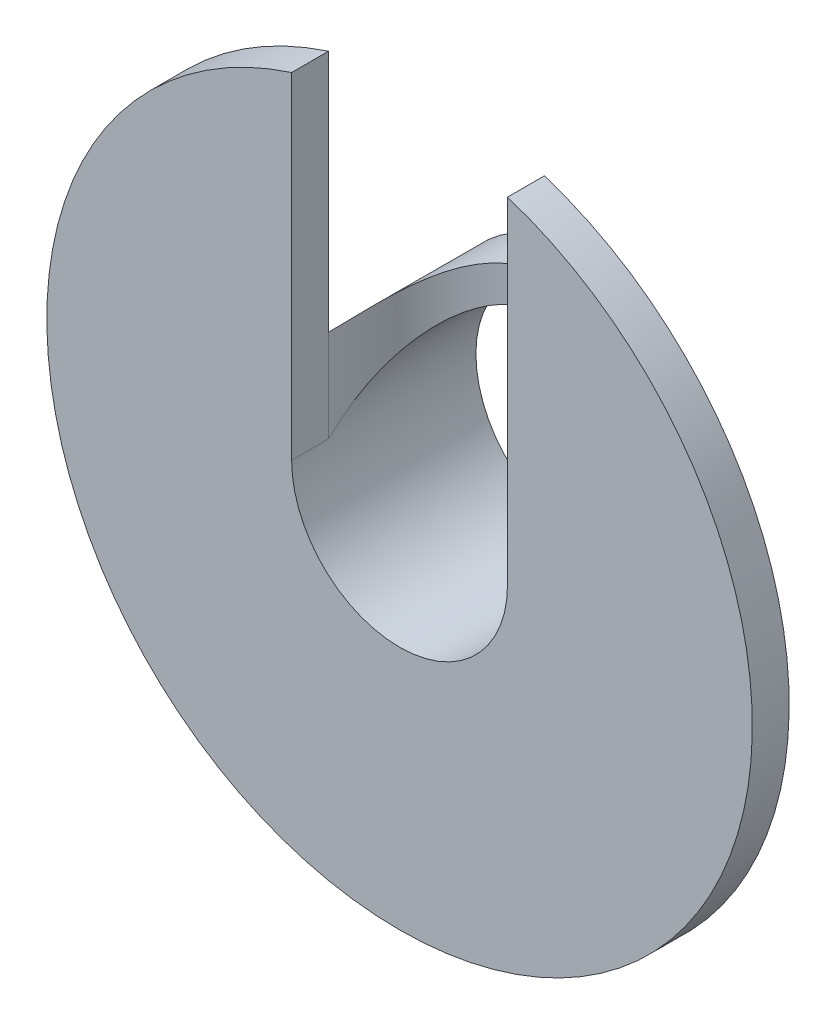
from build123d import *

# Parameters (mm, degrees)
BOSS_EXTRU_1_DEPTH      = 1.4
BOSS_EXTRU_2_START      = -7
ESQUISSE2_R             = 5.4
ESQUISSE2_R_2           = 4.1
BOSS_EXTRU_2_DEPTH      = 7
ENL_V_MAT_EXTRU_1_DEPTH = 7


with BuildPart() as part:
    # Esquisse1 → Boss.-Extru.1 (new body)
    with BuildSketch(Plane.XY):
        with BuildLine():
            Line((4.1, 0), (4.1, 12.757350822))
            ThreePointArc((4.1, 12.757350822), (0, -13.4), (-4.1, 12.757350822))
            Line((-4.1, 12.757350822), (-4.1, 0))
            ThreePointArc((-4.1, 0), (0, -4.1), (4.1, 0))
        make_face()
    extrude(amount=BOSS_EXTRU_1_DEPTH)

    # Esquisse2 → Boss.-Extru.2 (add)
    with BuildSketch(Plane.XY.offset(1.4).offset(BOSS_EXTRU_2_START)):
        Circle(ESQUISSE2_R)
        Circle(ESQUISSE2_R_2, mode=Mode.SUBTRACT)
    extrude(amount=BOSS_EXTRU_2_DEPTH)

    # Esquisse3 → Enlèv. mat.-Extru.1 (cut)
    with BuildSketch(Plane(origin=(0, 0, 0), x_dir=(1, 0, 0), z_dir=(0, 1, 0))):
        with BuildLine():
            Line((-4.1, -1.4), (-4.1, 0))
            ThreePointArc((-4.1, 0), (0, 4.1), (4.1, 0))
            Line((4.1, 0), (4.1, -1.4))
            Line((4.1, -1.4), (-4.1, -1.4))
        make_face()
    extrude(amount=ENL_V_MAT_EXTRU_1_DEPTH, mode=Mode.SUBTRACT)


solid = part.part
